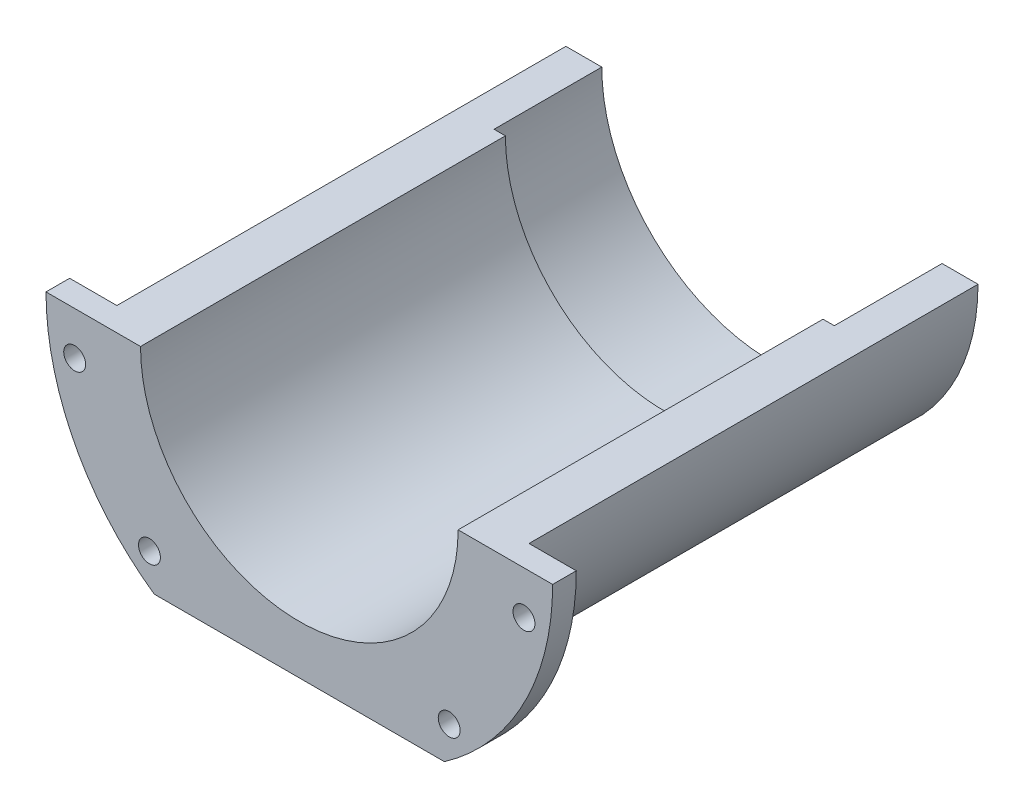
from build123d import *

# Parameters (mm, degrees)
SKETCH1_R               = 27.686
SKETCH1_R_2             = 21.336
BOSS_EXTRUDE1_DEPTH     = 63.5
BOSS_EXTRUDE2_START     = -3.175
SKETCH2_R               = 34.036
SKETCH2_R_2             = 27.686
BOSS_EXTRUDE2_DEPTH     = 3.175
CUT_EXTRUDE1_DEPTH      = 101.6
CUT_EXTRUDE1_DEPTH_BACK = 101.6
SKETCH3_W               = 97.716171251
SKETCH3_H               = 43.59719505
SKETCH4_R               = 1.4732
CUT_EXTRUDE2_DEPTH      = 101.6
SKETCH5_W               = 45.490276776
SKETCH5_H               = 8.374778988
CUT_EXTRUDE3_DEPTH      = 101.6
SKETCH6_R               = 22.86
CUT_EXTRUDE4_DEPTH      = 14.478


with BuildPart() as part:
    # Sketch1 → Boss-Extrude1 (new body)
    with BuildSketch(Plane.XY):
        Circle(SKETCH1_R)
        Circle(SKETCH1_R_2, mode=Mode.SUBTRACT)
    extrude(amount=BOSS_EXTRUDE1_DEPTH)

    # Sketch2 → Boss-Extrude2 (add)
    with BuildSketch(Plane.XY.offset(63.5).offset(BOSS_EXTRUDE2_START)):
        Circle(SKETCH2_R)
        Circle(SKETCH2_R_2, mode=Mode.SUBTRACT)
    extrude(amount=BOSS_EXTRUDE2_DEPTH)

    # Sketch3 → Cut-Extrude1 (cut, two sides: drawn at the far end of the back side and taken through both)
    with BuildSketch(Plane(origin=(0, 0, 60.325), x_dir=(-1, 0, 0), z_dir=(0, 0, -1)).offset(-CUT_EXTRUDE1_DEPTH_BACK)):
        with Locations((3.507260384, 21.798597525)):
            Rectangle(SKETCH3_W, SKETCH3_H)
    extrude(amount=CUT_EXTRUDE1_DEPTH + CUT_EXTRUDE1_DEPTH_BACK, mode=Mode.SUBTRACT)

    # Sketch4 → Cut-Extrude2 (cut)
    with BuildSketch(Plane(origin=(0, 0, 60.325), x_dir=(-1, 0, 0), z_dir=(0, 0, -1))):
        with Locations((-30.183908954, -5.789782512)):
            Circle(SKETCH4_R)
        with Locations((30.183908954, -5.789782512)):
            Circle(SKETCH4_R)
        with Locations((-20.137167932, -23.218191337)):
            Circle(SKETCH4_R)
        with Locations((20.137167932, -23.218191337)):
            Circle(SKETCH4_R)
        with Locations((0, -30.734181969)):
            Circle(SKETCH4_R)
    extrude(amount=-CUT_EXTRUDE2_DEPTH, mode=Mode.SUBTRACT)

    # Sketch5 → Cut-Extrude3 (cut)
    with BuildSketch(Plane(origin=(0, 0, 60.325), x_dir=(-1, 0, 0), z_dir=(0, 0, -1))):
        with Locations((-0.190335886, -32.086257649)):
            Rectangle(SKETCH5_W, SKETCH5_H)
    extrude(amount=-CUT_EXTRUDE3_DEPTH, mode=Mode.SUBTRACT)

    # Sketch6 → Cut-Extrude4 (cut)
    with BuildSketch(Plane(origin=(0, 0, 0), x_dir=(-1, 0, 0), z_dir=(0, 0, -1))):
        Circle(SKETCH6_R)
    extrude(amount=-CUT_EXTRUDE4_DEPTH, mode=Mode.SUBTRACT)


solid = part.part
